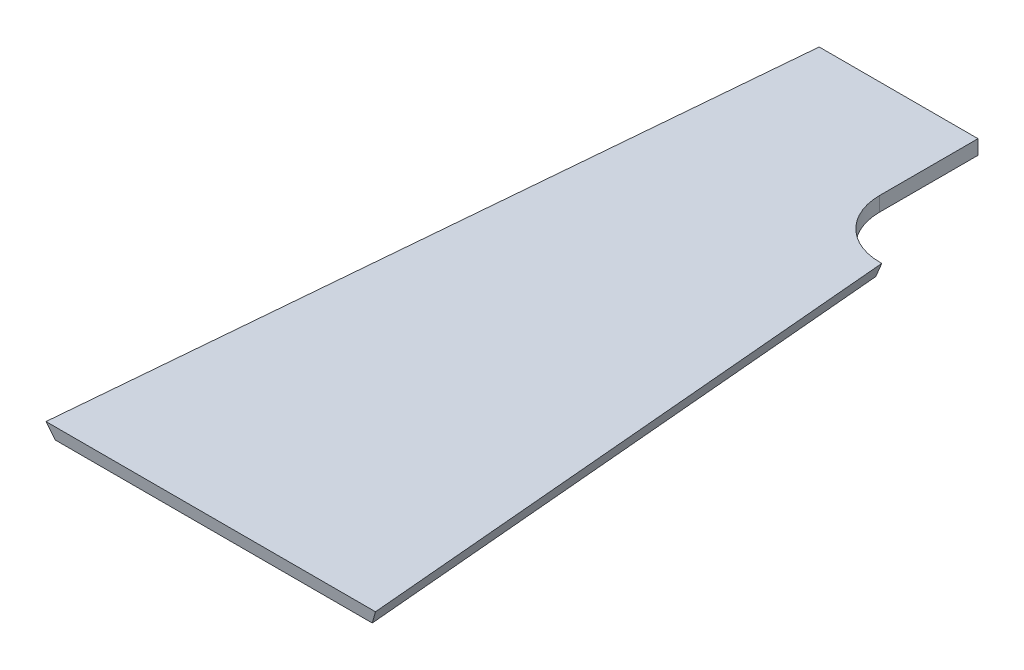
from build123d import *

# Parameters (mm, degrees)
SKIZZE1_W                            = 57
SKIZZE1_H                            = 123
AUFSATZ_LINEAR_AUSTRAGEN1_DEPTH      = 2.5
SCHNITT_LINEAR_AUSTRAGEN1_DEPTH      = 84.889808678
SCHNITT_LINEAR_AUSTRAGEN2_DEPTH      = 68.828828679
SCHNITT_LINEAR_AUSTRAGEN3_DEPTH      = 70.726045338
SCHNITT_LINEAR_AUSTRAGEN3_DEPTH_BACK = 70.726045338
SCHNITT_LINEAR_AUSTRAGEN4_DEPTH      = 70.47454308
SCHNITT_LINEAR_AUSTRAGEN4_DEPTH_BACK = 70.47454308
SCHNITT_LINEAR_AUSTRAGEN5_DEPTH      = 68.828828679


with BuildPart() as part:
    # Skizze1 → Aufsatz-Linear austragen1 (new body)
    with BuildSketch(Plane(origin=(0, 0, 0), x_dir=(1, 0, 0), z_dir=(0, 1, 0))):
        Rectangle(SKIZZE1_W, SKIZZE1_H)
    extrude(amount=AUFSATZ_LINEAR_AUSTRAGEN1_DEPTH)

    # Skizze2 → Schnitt-Linear austragen1 (cut, through all)
    with BuildSketch(Plane(origin=(28.5, 0, 0), x_dir=(0, 0, -1), z_dir=(1, 0, 0))):
        Polygon((-61.5, 2.5), (-61.5, 0), (-60.968608596, 0), align=None)
    extrude(amount=-SCHNITT_LINEAR_AUSTRAGEN1_DEPTH, mode=Mode.SUBTRACT)

    # Skizze3 → Schnitt-Linear austragen2 (cut, through all)
    with BuildSketch(Plane(origin=(0, 2.5, 0), x_dir=(1, 0, 0), z_dir=(0, 1, 0))):
        Polygon((-28.5, -61.5), (-17.738894386, 61.5), (-28.5, 61.5), align=None)
        Polygon((28.5, -61.5), (17.738894386, 61.5), (28.5, 61.5), align=None)
    extrude(amount=-SCHNITT_LINEAR_AUSTRAGEN2_DEPTH, mode=Mode.SUBTRACT)

    # Skizze5 → Schnitt-Linear austragen3 (cut, two sides: drawn at the far end of the back side and taken through both)
    with BuildSketch(Plane(origin=(0.175618176, 0, 2.007324937), x_dir=(0, -1, 0), z_dir=(0.08715574274765484, 0, 0.9961946980917459)).offset(-SCHNITT_LINEAR_AUSTRAGEN3_DEPTH_BACK)):
        Polygon((0.008562414, 23.031470717), (-2.5, 23.031470717), (0, 21.995936811), align=None)
    extrude(amount=SCHNITT_LINEAR_AUSTRAGEN3_DEPTH + SCHNITT_LINEAR_AUSTRAGEN3_DEPTH_BACK, mode=Mode.SUBTRACT)

    # Skizze6 → Schnitt-Linear austragen4 (cut, two sides: drawn at the far end of the back side and taken through both)
    with BuildSketch(Plane(origin=(-0.152372814, 0, 1.741629235), x_dir=(0, 1, 0), z_dir=(-0.08715574274766175, 0, 0.9961946980917452)).offset(-SCHNITT_LINEAR_AUSTRAGEN4_DEPTH_BACK)):
        Polygon((2.5, 23.031470717), (0, 21.995936811), (0, 23.031470717), align=None)
    extrude(amount=SCHNITT_LINEAR_AUSTRAGEN4_DEPTH + SCHNITT_LINEAR_AUSTRAGEN4_DEPTH_BACK, mode=Mode.SUBTRACT)

    # Skizze8 → Schnitt-Linear austragen5 (cut, through all)
    with BuildSketch(Plane(origin=(0, 2.5, 0), x_dir=(1, 0, 0), z_dir=(0, 1, 0))):
        with BuildLine():
            Line((17.738894386, 61.5), (9.738894386, 61.5))
            Line((9.738894386, 61.5), (9.738894386, 44.5))
            Line((9.738894386, 44.5), (9.738894386, 44.494341137))
            ThreePointArc((9.738894386, 44.494341137), (12.660237078, 37.430870976), (19.717416528, 34.494364202))
            Line((19.717416528, 34.494364202), (20.101653571, 34.493538941))
            Line((20.101653571, 34.493538941), (17.738894386, 61.5))
        make_face()
    extrude(amount=-SCHNITT_LINEAR_AUSTRAGEN5_DEPTH, mode=Mode.SUBTRACT)


solid = part.part
